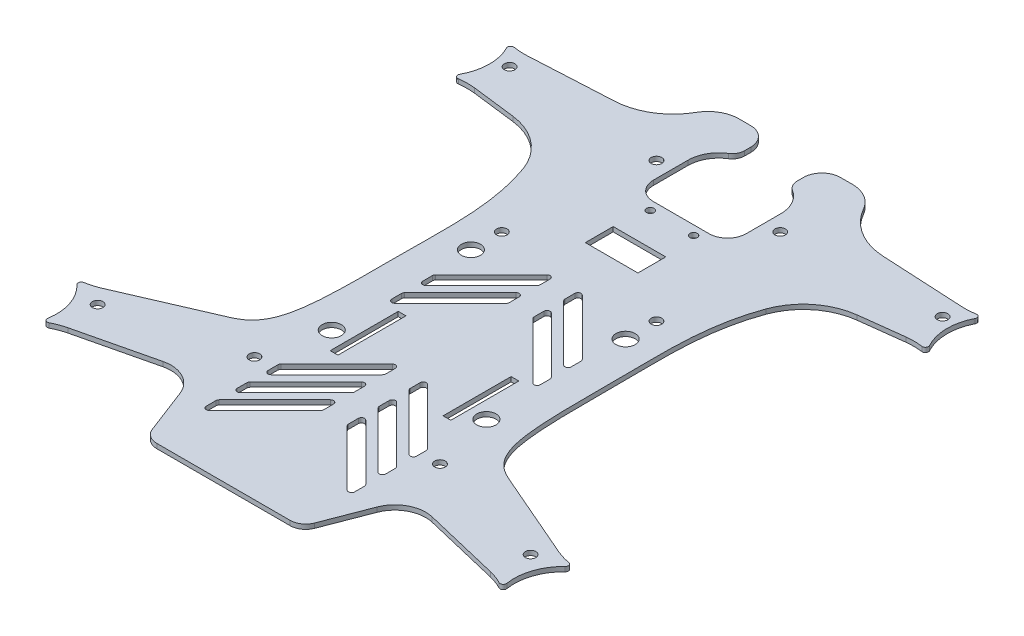
from build123d import *

# Parameters (mm, degrees)
BOSS_EXTRUDE1_DEPTH  = 1.5
SKETCH2_R            = 1.7
CUT_EXTRUDE1_DEPTH   = 125.646020416
SKETCH3_R            = 1.2
CUT_EXTRUDE2_DEPTH   = 125.646020416
FILLET1_R            = 6
FILLET2_R            = 4
FILLET3_R            = 10
FILLET4_R            = 6
SKETCH4_R            = 3.1
CUT_EXTRUDE3_DEPTH   = 125.646020416
SKETCH5_W            = 17
SKETCH5_H            = 9
CUT_EXTRUDE4_DEPTH   = 125.646020416
CUT_EXTRUDE5_DEPTH   = 125.646020416
FILLET5_R            = 1
FILLET5_OF_MIRROR1_R = 1
FILLET6_R            = 1
SKETCH7_W            = 2.5
SKETCH7_H            = 22
CUT_EXTRUDE6_DEPTH   = 124.714917748


with BuildPart() as part:
    # Sketch1 → Boss-Extrude1 (new body)
    with BuildSketch(Plane(origin=(0, 0, 0), x_dir=(1, 0, 0), z_dir=(0, 1, 0))):
        with BuildLine():
            Line((-31.855844053, -72.192605574), (-26.233363147, -86.79645805))
            ThreePointArc((-26.233363147, -86.79645805), (-24.397228464, -89.122031674), (-21.567236437, -90))
            Line((-21.567236437, -90), (21.567236437, -90))
            ThreePointArc((21.567236437, -90), (24.397228464, -89.122031674), (26.233363147, -86.79645805))
            Line((26.233363147, -86.79645805), (31.855844053, -72.192605574))
            ThreePointArc((31.855844053, -72.192605574), (36.531307149, -66.935984743), (43.511509738, -66.059178298))
            Line((43.511509738, -66.059178298), (68.242170627, -71.966796258))
            ThreePointArc((68.242170627, -71.966796258), (71.6188552, -73.099458399), (74.741095801, -74.813090758))
            ThreePointArc((74.741095801, -74.813090758), (74.821067231, -64.940355744), (80.680731096, -56.994184874))
            ThreePointArc((80.680731096, -56.994184874), (77.154759199, -56.491746401), (73.773814256, -55.37186537))
            Line((73.773814256, -55.37186537), (45, -42.89948064))
            add(Edge.make_bspline(
                [(45, -42.89948064), (36.343615545, -39.147258), (34.80960819, -29.268629503), (35.106939846, 13.356557741), (34.256047044, 32.267631522), (39.259712573, 46.130320799)],
                knots=[0, 0, 0, 0, 0.54924198, 0.64924198, 0.92262322, 0.92262322, 0.92262322, 0.92262322], degree=3))
            ThreePointArc((39.259712573, 46.130320799), (45.600580345, 54.975701767), (55.634402992, 59.191122465))
            Line((55.634402992, 59.191122465), (69.704149088, 60.918670062))
            ThreePointArc((69.704149088, 60.918670062), (73.46743544, 61.023748396), (77.183740648, 60.42171747))
            ThreePointArc((77.183740648, 60.42171747), (74.001667301, 69.769021935), (76.912564683, 79.204294478))
            ThreePointArc((76.912564683, 79.204294478), (73.622306438, 78.538318718), (70.267007874, 78.432042753))
            Line((70.267007874, 78.432042753), (43.365148071, 79.841909484))
            ThreePointArc((43.365148071, 79.841909484), (33.901209214, 82.799034603), (27.020546443, 89.938166726))
            ThreePointArc((27.020546443, 89.938166726), (23.355707706, 93.642385876), (18.324886066, 95))
            Line((18.324886066, 95), (-18.324886066, 95))
            ThreePointArc((-18.324886066, 95), (-23.355707706, 93.642385876), (-27.020546443, 89.938166726))
            ThreePointArc((-27.020546443, 89.938166726), (-33.901209214, 82.799034603), (-43.365148071, 79.841909484))
            Line((-43.365148071, 79.841909484), (-70.267007874, 78.432042753))
            ThreePointArc((-70.267007874, 78.432042753), (-73.622306438, 78.538318718), (-76.912564683, 79.204294478))
            ThreePointArc((-76.912564683, 79.204294478), (-74.001667301, 69.769021935), (-77.183740648, 60.42171747))
            ThreePointArc((-77.183740648, 60.42171747), (-73.46743544, 61.023748396), (-69.704149088, 60.918670062))
            Line((-69.704149088, 60.918670062), (-55.634402992, 59.191122465))
            ThreePointArc((-55.634402992, 59.191122465), (-45.600580345, 54.975701767), (-39.259712573, 46.130320799))
            add(Edge.make_bspline(
                [(-39.259712573, 46.130320799), (-34.256047044, 32.267631522), (-35.106939846, 13.356557741), (-34.80960819, -29.268629503), (-36.343615545, -39.147258), (-45, -42.89948064)],
                knots=[0.07737678, 0.07737678, 0.07737678, 0.07737678, 0.35075802, 0.45075802, 1, 1, 1, 1], degree=3))
            Line((-45, -42.89948064), (-73.773814256, -55.37186537))
            ThreePointArc((-73.773814256, -55.37186537), (-77.154759199, -56.491746401), (-80.680731096, -56.994184874))
            ThreePointArc((-80.680731096, -56.994184874), (-74.821067231, -64.940355744), (-74.741095801, -74.813090758))
            ThreePointArc((-74.741095801, -74.813090758), (-71.6188552, -73.099458399), (-68.242170627, -71.966796258))
            Line((-68.242170627, -71.966796258), (-43.511509738, -66.059178298))
            ThreePointArc((-43.511509738, -66.059178298), (-36.531307149, -66.935984743), (-31.855844053, -72.192605574))
        make_face()
    extrude(amount=BOSS_EXTRUDE1_DEPTH)

    # Sketch2 → Cut-Extrude1 (cut, through all)
    with BuildSketch(Plane(origin=(0, 1.5, 0), x_dir=(1, 0, 0), z_dir=(0, 1, 0))):
        with Locations(Location((-70, 72.5, 0), (0, 0, 270))):
            Circle(SKETCH2_R)
        with Locations(Location((-20, 70, 0), (0, 0, 270))):
            Circle(SKETCH2_R)
        with Locations(Location((20, 70, 0), (0, 0, 270))):
            Circle(SKETCH2_R)
        with Locations(Location((70, 72.5, 0), (0, 0, 270))):
            Circle(SKETCH2_R)
        with Locations(Location((30, -50, 0), (0, 0, 270))):
            Circle(SKETCH2_R)
        with Locations(Location((70, -60.69810195, 0), (0, 0, 270))):
            Circle(SKETCH2_R)
        with Locations(Location((-30, -50, 0), (0, 0, 270))):
            Circle(SKETCH2_R)
        with Locations(Location((-70, -60.69810195, 0), (0, 0, 270))):
            Circle(SKETCH2_R)
        with Locations(Location((-25, 25, 0), (0, 0, 270))):
            Circle(SKETCH2_R)
        with Locations(Location((25, 25, 0), (0, 0, 270))):
            Circle(SKETCH2_R)
    extrude(amount=-CUT_EXTRUDE1_DEPTH, mode=Mode.SUBTRACT)

    # Sketch3 → Cut-Extrude2 (cut, through all)
    with BuildSketch(Plane(origin=(0, 1.5, 0), x_dir=(1, 0, 0), z_dir=(0, 1, 0))):
        with Locations(Location((-7, 55, 0), (0, 0, 270))):
            Circle(SKETCH3_R)
        with Locations(Location((7, 55, 0), (0, 0, 270))):
            Circle(SKETCH3_R)
        Polygon((-8.5, 83), (-15, 83), (-15, 58), (15, 58), (15, 83), (8.5, 83), (8.5, 95), (-8.5, 95), align=None)
    extrude(amount=-CUT_EXTRUDE2_DEPTH, mode=Mode.SUBTRACT)

    # Fillet1
    fillet1_edges = [part.edges().sort_by_distance(p)[0] for p in [
        (-8.5, 0.75, -95),
        (8.5, 0.75, -95),
    ]]
    fillet(fillet1_edges, radius=FILLET1_R)

    # Fillet2
    fillet2_edges = [part.edges().sort_by_distance(p)[0] for p in [
        (-8.5, 0.75, -83),
        (8.5, 0.75, -83),
    ]]
    fillet(fillet2_edges, radius=FILLET2_R)

    # Fillet3
    fillet3_edges = [part.edges().sort_by_distance(p)[0] for p in [
        (15, 0.75, -83),
        (-15, 0.75, -83),
    ]]
    fillet(fillet3_edges, radius=FILLET3_R)

    # Fillet4
    fillet4_edges = [part.edges().sort_by_distance(p)[0] for p in [
        (-15, 0.75, -58),
        (15, 0.75, -58),
    ]]
    fillet(fillet4_edges, radius=FILLET4_R)

    # Sketch4 → Cut-Extrude3 (cut, through all)
    with BuildSketch(Plane(origin=(0, 1.5, 0), x_dir=(1, 0, 0), z_dir=(0, 1, 0))):
        with Locations(Location((-25, 15, 0), (0, 0, 270))):
            Circle(SKETCH4_R)
        with Locations(Location((25, 15, 0), (0, 0, 270))):
            Circle(SKETCH4_R)
        with Locations(Location((-25, -30, 0), (0, 0, 270))):
            Circle(SKETCH4_R)
        with Locations(Location((25, -30, 0), (0, 0, 270))):
            Circle(SKETCH4_R)
    extrude(amount=-CUT_EXTRUDE3_DEPTH, mode=Mode.SUBTRACT)

    # Sketch5 → Cut-Extrude4 (cut, through all)
    with BuildSketch(Plane(origin=(0, 1.5, 0), x_dir=(1, 0, 0), z_dir=(0, 1, 0))):
        with Locations((0, 40)):
            Rectangle(SKETCH5_W, SKETCH5_H)
    extrude(amount=-CUT_EXTRUDE4_DEPTH, mode=Mode.SUBTRACT)

    # Sketch6 → Cut-Extrude5 (cut, through all)
    with BuildSketch(Plane(origin=(0, 1.5, 0), x_dir=(1, 0, 0), z_dir=(0, 1, 0))):
        Polygon((-4, 22), (-4, 16), (-24, -4), (-24, 2), align=None)
        Polygon((-4, 12), (-4, 6), (-24, -14), (-24, -8), align=None)
        Polygon((-24, -48), (-4, -28), (-4, -34), (-24, -54), align=None)
        Polygon((-24, -58), (-4, -38), (-4, -44), (-24, -64), align=None)
        Polygon((-24, -68), (-4, -48), (-4, -54), (-24, -74), align=None)
    cut_extrude5 = extrude(amount=-CUT_EXTRUDE5_DEPTH, mode=Mode.SUBTRACT)

    # Fillet5
    fillet5_edges = [part.edges().sort_by_distance(p)[0] for p in [
        (-24, 0.75, -2),
        (-4, 0.75, -22),
        (-4, 0.75, -16),
        (-24, 0.75, 4),
        (-4, 0.75, 38),
        (-4, 0.75, 44),
        (-24, 0.75, 64),
        (-24, 0.75, 58),
        (-4, 0.75, 48),
        (-4, 0.75, 54),
        (-24, 0.75, 74),
        (-24, 0.75, 68),
        (-4, 0.75, 28),
        (-4, 0.75, 34),
        (-24, 0.75, 54),
        (-24, 0.75, 48),
        (-24, 0.75, 8),
        (-4, 0.75, -12),
        (-4, 0.75, -6),
        (-24, 0.75, 14),
    ]]
    fillet(fillet5_edges, radius=FILLET5_R)

    # Mirror1: Cut-Extrude5 across plane
    add(cut_extrude5.mirror(Plane(origin=(0, 0, 0), x_dir=(0, 0, 1), z_dir=(1, 0, 0))), mode=Mode.SUBTRACT)

    # Fillet5 of Mirror1
    fillet5_of_mirror1_edges = [part.edges().sort_by_distance(p)[0] for p in [
        (24, 0.75, -2),
        (4, 0.75, -22),
        (4, 0.75, -16),
        (24, 0.75, 4),
        (4, 0.75, 38),
        (4, 0.75, 44),
        (24, 0.75, 64),
        (24, 0.75, 58),
        (4, 0.75, 48),
        (4, 0.75, 54),
        (24, 0.75, 74),
        (24, 0.75, 68),
        (4, 0.75, 28),
        (4, 0.75, 34),
        (24, 0.75, 54),
        (24, 0.75, 48),
        (24, 0.75, 8),
        (4, 0.75, -12),
        (4, 0.75, -6),
        (24, 0.75, 14),
    ]]
    fillet(fillet5_of_mirror1_edges, radius=FILLET5_OF_MIRROR1_R)

    # Fillet6
    fillet6_edges = [part.edges().sort_by_distance(p)[0] for p in [
        (-74.741095801, 0.75, 74.813090758),
        (-80.680731096, 0.75, 56.994184874),
        (-77.183740648, 0.75, -60.42171747),
        (-76.912564683, 0.75, -79.204294478),
        (76.912564683, 0.75, -79.204294478),
        (77.183740648, 0.75, -60.42171747),
        (80.680731096, 0.75, 56.994184874),
        (74.741095801, 0.75, 74.813090758),
    ]]
    fillet(fillet6_edges, radius=FILLET6_R)

    # Sketch7 → Cut-Extrude6 (cut, through all)
    with BuildSketch(Plane(origin=(0, 1.5, 0), x_dir=(1, 0, 0), z_dir=(0, 1, 0))):
        with Locations((18.25, -25)):
            Rectangle(SKETCH7_W, SKETCH7_H)
        with Locations((-18.25, -25)):
            Rectangle(SKETCH7_W, SKETCH7_H)
    extrude(amount=-CUT_EXTRUDE6_DEPTH, mode=Mode.SUBTRACT)


solid = part.part
